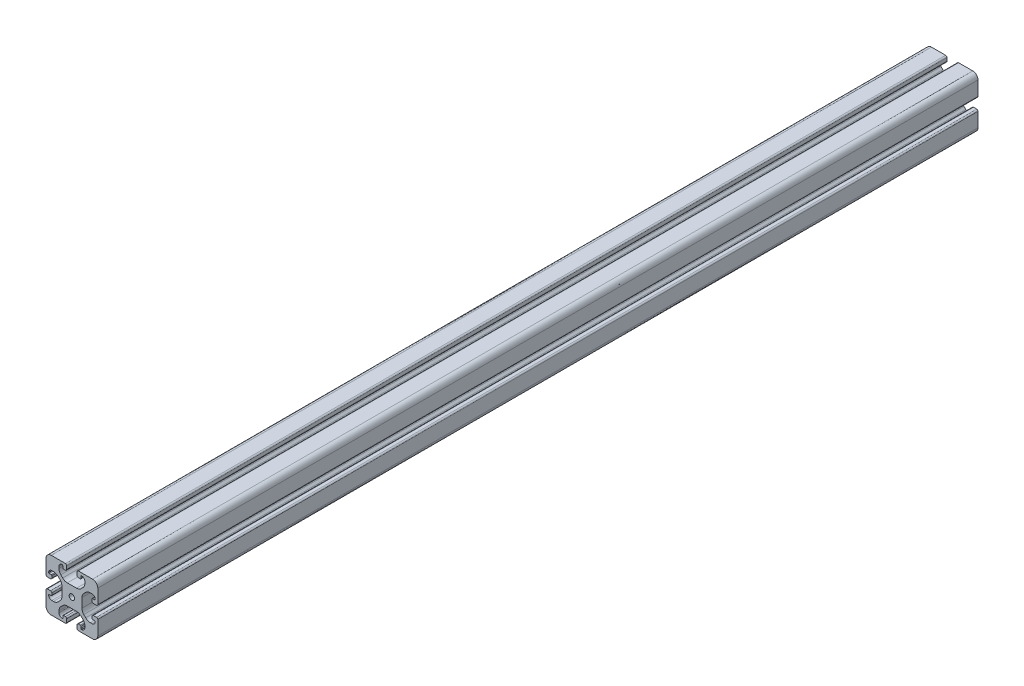
from build123d import *

# Parameters (mm, degrees)
EXTRUDE_3_DEPTH    = 680
HOLE_WIZARD_M5_1_D = 4.2
HOLE_WIZARD_M5_2_D = 4.2
HOLE_WIZARD_M5_3_D = 4.2


with BuildPart() as part:
    # Model → 凸台-拉伸3 (new body)
    with BuildSketch(Plane.XY):
        with BuildLine():
            Line((3038.626047963, 1538.554851823), (3045.741173633, 1538.554851823))
            add(Edge.make_bspline(
                [(3049.276921118, 1537.0902465), (3048.8107636, 1537.556481082), (3047.704647958, 1538.266080891), (3046.441138301, 1538.554851823), (3045.741173633, 1538.554851823)],
                knots=[0, 0, 0, 0, 0.489373028, 1, 1, 1, 1], degree=3))
            Line((3049.276921118, 1537.0902465), (3050.719115205, 1535.647813992))
            add(Edge.make_bspline(
                [(3052.183720448, 1532.112305099), (3052.183720448, 1532.801572394), (3051.892347197, 1534.083862245), (3051.192575602, 1535.174275324), (3050.719115205, 1535.647813992)],
                knots=[0, 0, 0, 0, 0.510203542, 1, 1, 1, 1], degree=3))
            Line((3052.183720448, 1532.112305099), (3052.183720448, 1530.804817427))
            add(Edge.make_bspline(
                [(3049.683663262, 1528.304760288), (3050.380891253, 1528.304760288), (3051.623803853, 1528.908542343), (3052.183720448, 1530.04566751), (3052.183720448, 1530.804817427)],
                knots=[0, 0, 0, 0, 0.502793736, 1, 1, 1, 1], degree=3))
            Line((3049.683663262, 1528.304760288), (3049.633595356, 1528.304760288))
            add(Edge.make_bspline(
                [(3049.183699488, 1528.754894547), (3049.183699488, 1528.621135634), (3049.310613574, 1528.399867559), (3049.514098722, 1528.304760288), (3049.633595356, 1528.304760288)],
                knots=[0, 0, 0, 0, 0.549542039, 1, 1, 1, 1], degree=3))
            Line((3049.183699488, 1528.754894547), (3049.183699488, 1530.304853729))
            add(Edge.make_bspline(
                [(3048.683735721, 1530.80481748), (3048.814583007, 1530.80481748), (3049.063948712, 1530.68728955), (3049.183699488, 1530.463207638), (3049.183699488, 1530.304853729)],
                knots=[0, 0, 0, 0, 0.482405948, 1, 1, 1, 1], degree=3))
            Line((3048.683735721, 1530.80481748), (3047.183606011, 1530.80481748))
            add(Edge.make_bspline(
                [(3046.183678534, 1529.804889962), (3046.183678534, 1530.108777492), (3046.477620245, 1530.598884032), (3046.929836169, 1530.80481748), (3047.183606011, 1530.80481748)],
                knots=[0, 0, 0, 0, 0.565195279, 1, 1, 1, 1], degree=3))
            Line((3046.183678534, 1529.804889962), (3046.183678534, 1527.304832729))
            add(Edge.make_bspline(
                [(3047.183606089, 1526.304666828), (3046.967197552, 1526.304664508), (3046.468490599, 1526.522616874), (3046.183678534, 1526.949099653), (3046.183678534, 1527.304832729)],
                knots=[0, 0, 0, 0, 0.421049349, 1, 1, 1, 1], degree=3))
            Line((3047.183606089, 1526.304666828), (3058.183762491, 1526.304784773))
            add(Edge.make_bspline(
                [(3058.183762491, 1526.304784773), (3059.53269494, 1526.304799236), (3061.276507698, 1527.365293091), (3062.183710881, 1529.362340035), (3062.183710881, 1530.304971497)],
                knots=[0, 0, 0, 0, 0.550544017, 1, 1, 1, 1], degree=3))
            Line((3062.183710881, 1530.304971497), (3062.183710881, 1541.304889481))
            add(Edge.make_bspline(
                [(3062.183710881, 1541.304889481), (3062.183710881, 1541.642072865), (3061.918643232, 1542.0781123), (3061.419310763, 1542.304817095), (3061.183545011, 1542.304817095)],
                knots=[0, 0, 0, 0, 0.550414522, 1, 1, 1, 1], degree=3))
            Line((3061.183545011, 1542.304817095), (3058.683726198, 1542.304817095))
            add(Edge.make_bspline(
                [(3058.683726198, 1542.304817095), (3058.347819216, 1542.304817095), (3057.911122877, 1542.041298811), (3057.683560264, 1541.542079896), (3057.683560264, 1541.30488962)],
                knots=[0, 0, 0, 0, 0.548463708, 1, 1, 1, 1], degree=3))
            Line((3057.683560264, 1541.30488962), (3057.683560264, 1539.804759902))
            add(Edge.make_bspline(
                [(3057.683560264, 1539.804759902), (3057.683560264, 1539.638611723), (3057.813635543, 1539.41945383), (3058.063313821, 1539.304796137), (3058.18376242, 1539.304796137)],
                knots=[0, 0, 0, 0, 0.543007867, 1, 1, 1, 1], degree=3))
            Line((3058.18376242, 1539.304796137), (3059.733721607, 1539.304796137))
            add(Edge.make_bspline(
                [(3059.733721607, 1539.304796137), (3059.900592531, 1539.304796137), (3060.08944904, 1539.170214152), (3060.183617459, 1538.946084099), (3060.183617459, 1538.854900293)],
                knots=[0, 0, 0, 0, 0.601271686, 1, 1, 1, 1], degree=3))
            Line((3060.183617459, 1538.854900293), (3060.183617459, 1538.804832319))
            add(Edge.make_bspline(
                [(3060.183617459, 1538.804832319), (3060.183617459, 1537.972969288), (3059.533728376, 1536.87693448), (3058.285558814, 1536.304775171), (3057.683560223, 1536.304775171)],
                knots=[0, 0, 0, 0, 0.54350612, 1, 1, 1, 1], degree=3))
            Line((3057.683560223, 1536.304775171), (3056.376072735, 1536.304775171))
            add(Edge.make_bspline(
                [(3056.376072735, 1536.304775171), (3055.697422379, 1536.304775171), (3054.429528001, 1536.577546077), (3053.324285242, 1537.285658909), (3052.840563739, 1537.769380411)],
                knots=[0, 0, 0, 0, 0.495306505, 1, 1, 1, 1], degree=3))
            Line((3052.840563739, 1537.769380411), (3051.398131257, 1539.211812893))
            add(Edge.make_bspline(
                [(3051.398131257, 1539.211812893), (3050.933823015, 1539.676121135), (3050.239839391, 1540.76814585), (3049.933764339, 1542.050783071), (3049.933764339, 1542.747322003)],
                knots=[0, 0, 0, 0, 0.481772339, 1, 1, 1, 1], degree=3))
            Line((3049.933764339, 1542.747322003), (3049.933764339, 1549.862447649))
            add(Edge.make_bspline(
                [(3051.398131257, 1553.39795676), (3050.933823015, 1552.933648518), (3050.239839391, 1551.841623803), (3049.933764339, 1550.558986582), (3049.933764339, 1549.862447649)],
                knots=[0, 0, 0, 0, 0.481772339, 1, 1, 1, 1], degree=3))
            Line((3051.398131257, 1553.39795676), (3052.840563739, 1554.840389241))
            add(Edge.make_bspline(
                [(3056.376072735, 1556.304994482), (3055.697422379, 1556.304994482), (3054.429528001, 1556.032223576), (3053.324285242, 1555.324110744), (3052.840563739, 1554.840389241)],
                knots=[0, 0, 0, 0, 0.495306505, 1, 1, 1, 1], degree=3))
            Line((3056.376072735, 1556.304994482), (3057.683560223, 1556.304994482))
            add(Edge.make_bspline(
                [(3060.183617459, 1553.804937334), (3060.183617459, 1554.636800364), (3059.533728376, 1555.732835172), (3058.285558814, 1556.304994482), (3057.683560223, 1556.304994482)],
                knots=[0, 0, 0, 0, 0.54350612, 1, 1, 1, 1], degree=3))
            Line((3060.183617459, 1553.804937334), (3060.183617459, 1553.75486936))
            add(Edge.make_bspline(
                [(3059.733721607, 1553.304973516), (3059.900592531, 1553.304973516), (3060.08944904, 1553.4395555), (3060.183617459, 1553.663685553), (3060.183617459, 1553.75486936)],
                knots=[0, 0, 0, 0, 0.601271686, 1, 1, 1, 1], degree=3))
            Line((3059.733721607, 1553.304973516), (3058.18376242, 1553.304973516))
            add(Edge.make_bspline(
                [(3057.683560264, 1552.80500975), (3057.683560264, 1552.97115793), (3057.813635543, 1553.190315823), (3058.063313821, 1553.304973516), (3058.18376242, 1553.304973516)],
                knots=[0, 0, 0, 0, 0.543007867, 1, 1, 1, 1], degree=3))
            Line((3057.683560264, 1552.80500975), (3057.683560264, 1551.304880033))
            add(Edge.make_bspline(
                [(3058.683726198, 1550.304952558), (3058.347819216, 1550.304952558), (3057.911122877, 1550.568470841), (3057.683560264, 1551.067689757), (3057.683560264, 1551.304880033)],
                knots=[0, 0, 0, 0, 0.548463708, 1, 1, 1, 1], degree=3))
            Line((3058.683726198, 1550.304952558), (3061.183545011, 1550.304952558))
            add(Edge.make_bspline(
                [(3062.183710881, 1551.304880172), (3062.183710881, 1550.967696788), (3061.918643232, 1550.531657353), (3061.419310763, 1550.304952558), (3061.183545011, 1550.304952558)],
                knots=[0, 0, 0, 0, 0.550414522, 1, 1, 1, 1], degree=3))
            Line((3062.183710881, 1551.304880172), (3062.183710881, 1562.304798156))
            add(Edge.make_bspline(
                [(3058.183762491, 1566.30498488), (3059.53269494, 1566.304970416), (3061.276507698, 1565.244476562), (3062.183710881, 1563.247429618), (3062.183710881, 1562.304798156)],
                knots=[0, 0, 0, 0, 0.550544017, 1, 1, 1, 1], degree=3))
            Line((3058.183762491, 1566.30498488), (3047.183606089, 1566.305102825))
            add(Edge.make_bspline(
                [(3047.183606089, 1566.305102825), (3046.967197552, 1566.305105145), (3046.468490599, 1566.087152778), (3046.183678534, 1565.66067), (3046.183678534, 1565.304936924)],
                knots=[0, 0, 0, 0, 0.421049349, 1, 1, 1, 1], degree=3))
            Line((3046.183678534, 1565.304936924), (3046.183678534, 1562.804879691))
            add(Edge.make_bspline(
                [(3046.183678534, 1562.804879691), (3046.183678534, 1562.500992161), (3046.477620245, 1562.010885621), (3046.929836169, 1561.804952173), (3047.183606011, 1561.804952173)],
                knots=[0, 0, 0, 0, 0.565195279, 1, 1, 1, 1], degree=3))
            Line((3047.183606011, 1561.804952173), (3048.683735721, 1561.804952173))
            add(Edge.make_bspline(
                [(3048.683735721, 1561.804952173), (3048.814583007, 1561.804952173), (3049.063948712, 1561.922480103), (3049.183699488, 1562.146562015), (3049.183699488, 1562.304915923)],
                knots=[0, 0, 0, 0, 0.482405948, 1, 1, 1, 1], degree=3))
            Line((3049.183699488, 1562.304915923), (3049.183699488, 1563.854875106))
            add(Edge.make_bspline(
                [(3049.183699488, 1563.854875106), (3049.183699488, 1563.988634019), (3049.310613574, 1564.209902094), (3049.514098722, 1564.305009365), (3049.633595356, 1564.305009365)],
                knots=[0, 0, 0, 0, 0.549542039, 1, 1, 1, 1], degree=3))
            Line((3049.633595356, 1564.305009365), (3049.683663262, 1564.305009365))
            add(Edge.make_bspline(
                [(3049.683663262, 1564.305009365), (3050.380891253, 1564.305009365), (3051.623803853, 1563.70122731), (3052.183720448, 1562.564102142), (3052.183720448, 1561.804952226)],
                knots=[0, 0, 0, 0, 0.502793736, 1, 1, 1, 1], degree=3))
            Line((3052.183720448, 1561.804952226), (3052.183720448, 1560.497464554))
            add(Edge.make_bspline(
                [(3052.183720448, 1560.497464554), (3052.183720448, 1559.808197259), (3051.892347197, 1558.525907408), (3051.192575602, 1557.435494329), (3050.719115205, 1556.961955661)],
                knots=[0, 0, 0, 0, 0.510203542, 1, 1, 1, 1], degree=3))
            Line((3050.719115205, 1556.961955661), (3049.276921118, 1555.519523152))
            add(Edge.make_bspline(
                [(3049.276921118, 1555.519523152), (3048.8107636, 1555.05328857), (3047.704647958, 1554.343688762), (3046.441138301, 1554.05491783), (3045.741173633, 1554.05491783)],
                knots=[0, 0, 0, 0, 0.489373028, 1, 1, 1, 1], degree=3))
            Line((3045.741173633, 1554.05491783), (3038.626047963, 1554.05491783))
            add(Edge.make_bspline(
                [(3035.090300479, 1555.519523152), (3035.556457996, 1555.05328857), (3036.662573638, 1554.343688762), (3037.926083295, 1554.05491783), (3038.626047963, 1554.05491783)],
                knots=[0, 0, 0, 0, 0.489373028, 1, 1, 1, 1], degree=3))
            Line((3035.090300479, 1555.519523152), (3033.648106391, 1556.961955661))
            add(Edge.make_bspline(
                [(3032.183501148, 1560.497464554), (3032.183501148, 1559.808197259), (3032.474874399, 1558.525907408), (3033.174645994, 1557.435494329), (3033.648106391, 1556.961955661)],
                knots=[0, 0, 0, 0, 0.510203542, 1, 1, 1, 1], degree=3))
            Line((3032.183501148, 1560.497464554), (3032.183501148, 1561.804952226))
            add(Edge.make_bspline(
                [(3034.683558334, 1564.305009365), (3033.986330343, 1564.305009365), (3032.743417743, 1563.70122731), (3032.183501148, 1562.564102142), (3032.183501148, 1561.804952226)],
                knots=[0, 0, 0, 0, 0.502793736, 1, 1, 1, 1], degree=3))
            Line((3034.683558334, 1564.305009365), (3034.73362624, 1564.305009365))
            add(Edge.make_bspline(
                [(3035.183522108, 1563.854875106), (3035.183522108, 1563.988634019), (3035.056608022, 1564.209902094), (3034.853122874, 1564.305009365), (3034.73362624, 1564.305009365)],
                knots=[0, 0, 0, 0, 0.549542039, 1, 1, 1, 1], degree=3))
            Line((3035.183522108, 1563.854875106), (3035.183522108, 1562.304915923))
            add(Edge.make_bspline(
                [(3035.683485875, 1561.804952173), (3035.552638589, 1561.804952173), (3035.303272884, 1561.922480103), (3035.183522108, 1562.146562015), (3035.183522108, 1562.304915923)],
                knots=[0, 0, 0, 0, 0.482405948, 1, 1, 1, 1], degree=3))
            Line((3035.683485875, 1561.804952173), (3037.183615585, 1561.804952173))
            add(Edge.make_bspline(
                [(3038.183543062, 1562.804879691), (3038.183543062, 1562.500992161), (3037.889601351, 1562.010885621), (3037.437385427, 1561.804952173), (3037.183615585, 1561.804952173)],
                knots=[0, 0, 0, 0, 0.565195279, 1, 1, 1, 1], degree=3))
            Line((3038.183543062, 1562.804879691), (3038.183543062, 1565.304936924))
            add(Edge.make_bspline(
                [(3037.183615507, 1566.305102825), (3037.400024044, 1566.305105145), (3037.898730997, 1566.087152778), (3038.183543062, 1565.66067), (3038.183543062, 1565.304936924)],
                knots=[0, 0, 0, 0, 0.421049349, 1, 1, 1, 1], degree=3))
            Line((3037.183615507, 1566.305102825), (3026.183459105, 1566.30498488))
            add(Edge.make_bspline(
                [(3026.183459105, 1566.30498488), (3024.834526656, 1566.304970416), (3023.090713898, 1565.244476562), (3022.183510715, 1563.247429618), (3022.183510715, 1562.304798156)],
                knots=[0, 0, 0, 0, 0.550544017, 1, 1, 1, 1], degree=3))
            Line((3022.183510715, 1562.304798156), (3022.183510715, 1551.304880172))
            add(Edge.make_bspline(
                [(3022.183510715, 1551.304880172), (3022.183510715, 1550.967696788), (3022.448578364, 1550.531657353), (3022.947910833, 1550.304952558), (3023.183676585, 1550.304952558)],
                knots=[0, 0, 0, 0, 0.550414522, 1, 1, 1, 1], degree=3))
            Line((3023.183676585, 1550.304952558), (3025.683495398, 1550.304952558))
            add(Edge.make_bspline(
                [(3025.683495398, 1550.304952558), (3026.01940238, 1550.304952558), (3026.45609872, 1550.568470841), (3026.683661332, 1551.067689757), (3026.683661332, 1551.304880033)],
                knots=[0, 0, 0, 0, 0.548463708, 1, 1, 1, 1], degree=3))
            Line((3026.683661332, 1551.304880033), (3026.683661332, 1552.80500975))
            add(Edge.make_bspline(
                [(3026.683661332, 1552.80500975), (3026.683661332, 1552.97115793), (3026.553586053, 1553.190315823), (3026.303907775, 1553.304973516), (3026.183459176, 1553.304973516)],
                knots=[0, 0, 0, 0, 0.543007867, 1, 1, 1, 1], degree=3))
            Line((3026.183459176, 1553.304973516), (3024.633499989, 1553.304973516))
            add(Edge.make_bspline(
                [(3024.633499989, 1553.304973516), (3024.466629065, 1553.304973516), (3024.277772556, 1553.4395555), (3024.183604137, 1553.663685553), (3024.183604137, 1553.75486936)],
                knots=[0, 0, 0, 0, 0.601271686, 1, 1, 1, 1], degree=3))
            Line((3024.183604137, 1553.75486936), (3024.183604137, 1553.804937334))
            add(Edge.make_bspline(
                [(3024.183604137, 1553.804937334), (3024.183604137, 1554.636800364), (3024.833493221, 1555.732835172), (3026.081662782, 1556.304994482), (3026.683661373, 1556.304994482)],
                knots=[0, 0, 0, 0, 0.54350612, 1, 1, 1, 1], degree=3))
            Line((3026.683661373, 1556.304994482), (3027.991148861, 1556.304994482))
            add(Edge.make_bspline(
                [(3027.991148861, 1556.304994482), (3028.669799217, 1556.304994482), (3029.937693595, 1556.032223576), (3031.042936355, 1555.324110744), (3031.526657857, 1554.840389241)],
                knots=[0, 0, 0, 0, 0.495306505, 1, 1, 1, 1], degree=3))
            Line((3031.526657857, 1554.840389241), (3032.969090339, 1553.39795676))
            add(Edge.make_bspline(
                [(3032.969090339, 1553.39795676), (3033.433398581, 1552.933648518), (3034.127382205, 1551.841623803), (3034.433457257, 1550.558986582), (3034.433457257, 1549.862447649)],
                knots=[0, 0, 0, 0, 0.481772339, 1, 1, 1, 1], degree=3))
            Line((3034.433457257, 1549.862447649), (3034.433457257, 1542.747322003))
            add(Edge.make_bspline(
                [(3032.969090339, 1539.211812893), (3033.433398581, 1539.676121135), (3034.127382205, 1540.76814585), (3034.433457257, 1542.050783071), (3034.433457257, 1542.747322003)],
                knots=[0, 0, 0, 0, 0.481772339, 1, 1, 1, 1], degree=3))
            Line((3032.969090339, 1539.211812893), (3031.526657857, 1537.769380411))
            add(Edge.make_bspline(
                [(3027.991148861, 1536.304775171), (3028.669799217, 1536.304775171), (3029.937693595, 1536.577546077), (3031.042936355, 1537.285658909), (3031.526657857, 1537.769380411)],
                knots=[0, 0, 0, 0, 0.495306505, 1, 1, 1, 1], degree=3))
            Line((3027.991148861, 1536.304775171), (3026.683661373, 1536.304775171))
            add(Edge.make_bspline(
                [(3024.183604137, 1538.804832319), (3024.183604137, 1537.972969288), (3024.833493221, 1536.87693448), (3026.081662782, 1536.304775171), (3026.683661373, 1536.304775171)],
                knots=[0, 0, 0, 0, 0.54350612, 1, 1, 1, 1], degree=3))
            Line((3024.183604137, 1538.804832319), (3024.183604137, 1538.854900293))
            add(Edge.make_bspline(
                [(3024.633499989, 1539.304796137), (3024.466629065, 1539.304796137), (3024.277772556, 1539.170214152), (3024.183604137, 1538.946084099), (3024.183604137, 1538.854900293)],
                knots=[0, 0, 0, 0, 0.601271686, 1, 1, 1, 1], degree=3))
            Line((3024.633499989, 1539.304796137), (3026.183459176, 1539.304796137))
            add(Edge.make_bspline(
                [(3026.683661332, 1539.804759902), (3026.683661332, 1539.638611723), (3026.553586053, 1539.41945383), (3026.303907775, 1539.304796137), (3026.183459176, 1539.304796137)],
                knots=[0, 0, 0, 0, 0.543007867, 1, 1, 1, 1], degree=3))
            Line((3026.683661332, 1539.804759902), (3026.683661332, 1541.30488962))
            add(Edge.make_bspline(
                [(3025.683495398, 1542.304817095), (3026.01940238, 1542.304817095), (3026.45609872, 1542.041298811), (3026.683661332, 1541.542079896), (3026.683661332, 1541.30488962)],
                knots=[0, 0, 0, 0, 0.548463708, 1, 1, 1, 1], degree=3))
            Line((3025.683495398, 1542.304817095), (3023.183676585, 1542.304817095))
            add(Edge.make_bspline(
                [(3022.183510715, 1541.304889481), (3022.183510715, 1541.642072865), (3022.448578364, 1542.0781123), (3022.947910833, 1542.304817095), (3023.183676585, 1542.304817095)],
                knots=[0, 0, 0, 0, 0.550414522, 1, 1, 1, 1], degree=3))
            Line((3022.183510715, 1541.304889481), (3022.183510715, 1530.304971497))
            add(Edge.make_bspline(
                [(3026.183459105, 1526.304784773), (3024.834526656, 1526.304799236), (3023.090713898, 1527.365293091), (3022.183510715, 1529.362340035), (3022.183510715, 1530.304971497)],
                knots=[0, 0, 0, 0, 0.550544017, 1, 1, 1, 1], degree=3))
            Line((3026.183459105, 1526.304784773), (3037.183615507, 1526.304666828))
            add(Edge.make_bspline(
                [(3037.183615507, 1526.304666828), (3037.400024044, 1526.304664508), (3037.898730997, 1526.522616874), (3038.183543062, 1526.949099653), (3038.183543062, 1527.304832729)],
                knots=[0, 0, 0, 0, 0.421049349, 1, 1, 1, 1], degree=3))
            Line((3038.183543062, 1527.304832729), (3038.183543062, 1529.804889962))
            add(Edge.make_bspline(
                [(3038.183543062, 1529.804889962), (3038.183543062, 1530.108777492), (3037.889601351, 1530.598884032), (3037.437385427, 1530.80481748), (3037.183615585, 1530.80481748)],
                knots=[0, 0, 0, 0, 0.565195279, 1, 1, 1, 1], degree=3))
            Line((3037.183615585, 1530.80481748), (3035.683485875, 1530.80481748))
            add(Edge.make_bspline(
                [(3035.683485875, 1530.80481748), (3035.552638589, 1530.80481748), (3035.303272884, 1530.68728955), (3035.183522108, 1530.463207638), (3035.183522108, 1530.304853729)],
                knots=[0, 0, 0, 0, 0.482405948, 1, 1, 1, 1], degree=3))
            Line((3035.183522108, 1530.304853729), (3035.183522108, 1528.754894547))
            add(Edge.make_bspline(
                [(3035.183522108, 1528.754894547), (3035.183522108, 1528.621135634), (3035.056608022, 1528.399867559), (3034.853122874, 1528.304760288), (3034.73362624, 1528.304760288)],
                knots=[0, 0, 0, 0, 0.549542039, 1, 1, 1, 1], degree=3))
            Line((3034.73362624, 1528.304760288), (3034.683558334, 1528.304760288))
            add(Edge.make_bspline(
                [(3034.683558334, 1528.304760288), (3033.986330343, 1528.304760288), (3032.743417743, 1528.908542343), (3032.183501148, 1530.04566751), (3032.183501148, 1530.804817427)],
                knots=[0, 0, 0, 0, 0.502793736, 1, 1, 1, 1], degree=3))
            Line((3032.183501148, 1530.804817427), (3032.183501148, 1532.112305099))
            add(Edge.make_bspline(
                [(3032.183501148, 1532.112305099), (3032.183501148, 1532.801572394), (3032.474874399, 1534.083862245), (3033.174645994, 1535.174275324), (3033.648106391, 1535.647813992)],
                knots=[0, 0, 0, 0, 0.510203542, 1, 1, 1, 1], degree=3))
            Line((3033.648106391, 1535.647813992), (3035.090300479, 1537.0902465))
            add(Edge.make_bspline(
                [(3035.090300479, 1537.0902465), (3035.556457996, 1537.556481082), (3036.662573638, 1538.266080891), (3037.926083295, 1538.554851823), (3038.626047963, 1538.554851823)],
                knots=[0, 0, 0, 0, 0.489373028, 1, 1, 1, 1], degree=3))
        make_face()
    extrude(amount=EXTRUDE_3_DEPTH)

    # M5 螺纹孔1 (through all)
    with Locations(Plane.XY.offset(680)):
        with Locations((3042.183610798, 1546.304884826)):
            Hole(HOLE_WIZARD_M5_1_D / 2)

    # M5 螺纹孔2 (through all)
    with Locations(Plane(origin=(3049.933764339, 0, 0), x_dir=(0, 0, -1), z_dir=(1, 0, 0))):
        with Locations((-340, 1546.304884826)):
            Hole(HOLE_WIZARD_M5_2_D / 2)

    # M5 螺纹孔3 (through all)
    with Locations(Plane(origin=(0, 1554.05491783, 0), x_dir=(1, 0, 0), z_dir=(0, 1, 0))):
        with Locations((3042.183610798, -340)):
            Hole(HOLE_WIZARD_M5_3_D / 2)


solid = part.part
